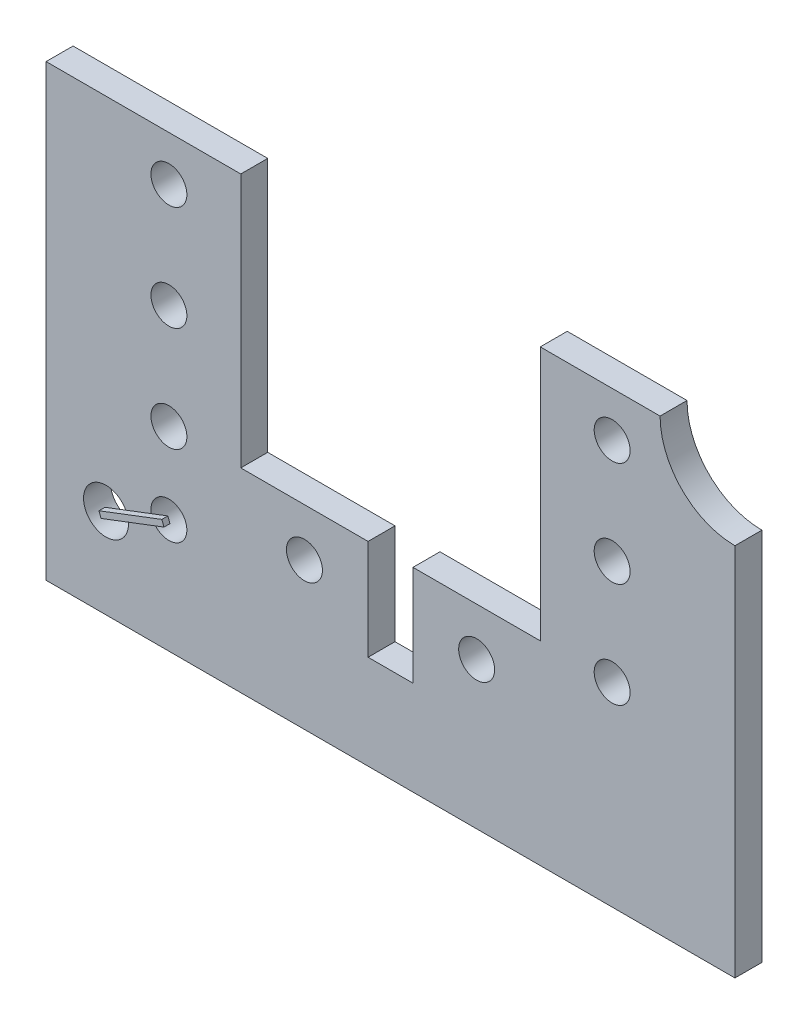
from build123d import *

# Parameters (mm, degrees)
EXTRUDE_1_DEPTH     = 0.45
CUT_EXTRUDE_1_DEPTH = 5
SKETCH_4_R          = 0.75
SKETCH_4_R_2        = 0.6
CUT_EXTRUDE_3_DEPTH = 5
EXTRUDE_1_2_DEPTH   = 0.2
EXTRUDE_2_DEPTH     = 0.2


with BuildPart() as part:
    # Эскиз1 → Extrude 1 (new, symmetric)
    with BuildSketch(Plane.XY):
        with BuildLine():
            Line((-11.5, -18.5), (11.5, -18.5))
            Line((11.5, -18.5), (11.5, -6))
            ThreePointArc((11.5, -6), (9.732233047, -5.267766953), (9, -3.5))
            Line((9, -3.5), (5, -3.5))
            Line((5, -3.5), (5, -12))
            Line((5, -12), (-5, -12))
            Line((-5, -12), (-5, -3.5))
            Line((-5, -3.5), (-9, -3.5))
            Line((-9, -3.5), (-11.5, -3.5))
            Line((-11.5, -3.5), (-11.5, -6))
            Line((-11.5, -6), (-11.5, -18.5))
        make_face()
    extrude(amount=EXTRUDE_1_DEPTH, both=True)

    # Эскиз2 → Вырез-Вытянуть1 (cut, symmetric)
    with BuildSketch(Plane.XY):
        Polygon((-0.75, -15.25), (-0.75, -12), (0.75, -12), (0.75, -15.25), (0.75, -15.35), (-0.75, -15.35), align=None)
    extrude(amount=CUT_EXTRUDE_1_DEPTH, both=True, mode=Mode.SUBTRACT)

    # Эскиз4 → Вырез-Вытянуть3 (cut, symmetric)
    with BuildSketch(Plane.XY):
        with Locations((-9.5, -15.5)):
            Circle(SKETCH_4_R)
        with Locations((-2.875, -13.6)):
            Circle(SKETCH_4_R_2)
        with Locations((-7.4, -14.7)):
            Circle(SKETCH_4_R_2)
        with Locations((-7.4, -8.5)):
            Circle(SKETCH_4_R_2)
        with Locations((-7.4, -5)):
            Circle(SKETCH_4_R_2)
        with Locations((7.4, -8.5)):
            Circle(SKETCH_4_R_2)
        with Locations((7.4, -5)):
            Circle(SKETCH_4_R_2)
        with Locations((2.875, -13.6)):
            Circle(SKETCH_4_R_2)
        with Locations((-7.4, -12)):
            Circle(SKETCH_4_R_2)
        with Locations((7.4, -12)):
            Circle(SKETCH_4_R_2)
    extrude(amount=CUT_EXTRUDE_3_DEPTH, both=True, mode=Mode.SUBTRACT)

    # Эскиз5 → Extrude 1 2 (add)
    with BuildSketch(Plane(origin=(0, 0, 0.45), x_dir=(-1, 0, 0), z_dir=(0, 0, -1))):
        Polygon((9.535599533, -15.406551227), (7.435599533, -14.606551227), (7.364400467, -14.793448773), (9.464400467, -15.593448773), align=None)
    extrude(amount=-EXTRUDE_1_2_DEPTH)

    # Эскиз6 → Вытянуть-Тонкостенный2 (add)
    with BuildSketch(Plane(origin=(0, 0, -0.45), x_dir=(-1, 0, 0), z_dir=(0, 0, -1))):
        Polygon((2.847835322, -13.711745605), (7.372835322, -14.811745605), (7.427164678, -14.588254395), (2.902164678, -13.488254395), align=None)
    extrude(amount=EXTRUDE_2_DEPTH)


solid = part.part
